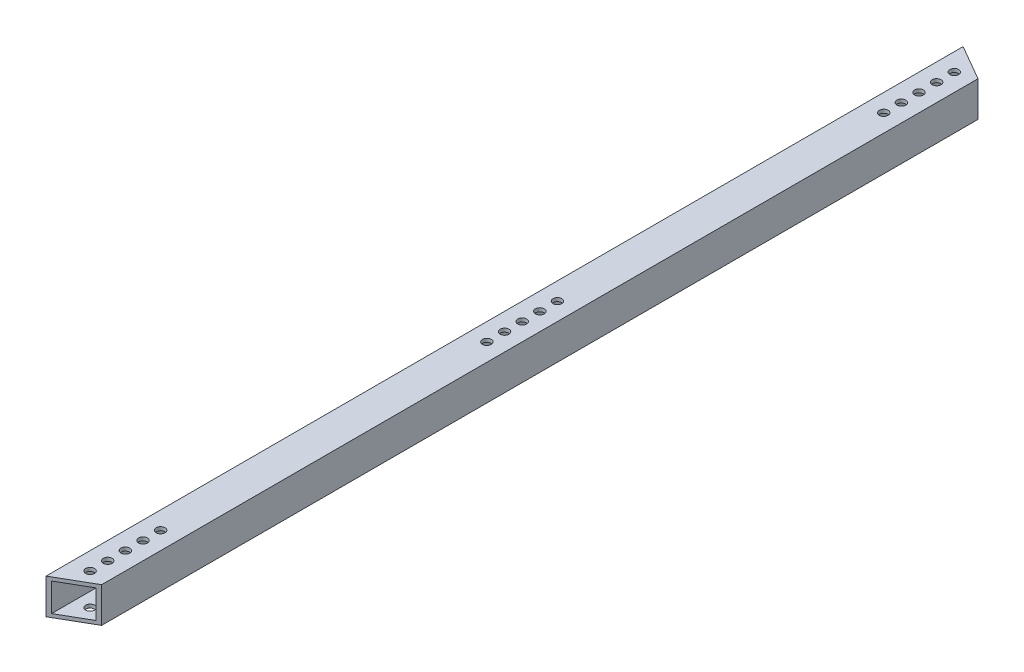
from build123d import *

# Parameters (mm, degrees)
SKETCH1_W           = 25.4
SKETCH1_H           = 25.4
SKETCH1_W_2         = 20.32
SKETCH1_H_2         = 20.32
BOSS_EXTRUDE2_DEPTH = 660.4
CUT_EXTRUDE1_DEPTH  = 662.010294927
SKETCH3_R           = 3.175
CUT_EXTRUDE2_DEPTH  = 662.010294927


with BuildPart() as part:
    # Sketch1 → Boss-Extrude2 (new body)
    with BuildSketch(Plane.XY):
        Rectangle(SKETCH1_W, SKETCH1_H)
        Rectangle(SKETCH1_W_2, SKETCH1_H_2, mode=Mode.SUBTRACT)
    extrude(amount=BOSS_EXTRUDE2_DEPTH)

    # Sketch2 → Cut-Extrude1 (cut, through all)
    with BuildSketch(Plane(origin=(0, 12.7, 0), x_dir=(1, 0, 0), z_dir=(0, 1, 0))):
        Polygon((-12.7, -660.4), (12.7, -645.735303163), (12.7, -660.4), align=None)
        Polygon((12.7, 0), (-12.7, 0), (12.7, -14.664696837), align=None)
    extrude(amount=-CUT_EXTRUDE1_DEPTH, mode=Mode.SUBTRACT)

    # Sketch3 → Cut-Extrude2 (cut, through all)
    with BuildSketch(Plane(origin=(0, 12.7, 0), x_dir=(1, 0, 0), z_dir=(0, 1, 0))):
        with Locations(Location((0, -330.2, 0), (0, 0, 270))):
            Circle(SKETCH3_R)
        with Locations(Location((0, -317.5, 0), (0, 0, 270))):
            Circle(SKETCH3_R)
        with Locations(Location((0, -304.8, 0), (0, 0, 270))):
            Circle(SKETCH3_R)
        with Locations((0, -355.6)):
            Circle(SKETCH3_R)
        with Locations((0, -342.9)):
            Circle(SKETCH3_R)
        with Locations(Location((0, -641.35, 0), (0, 0, 270))):
            Circle(SKETCH3_R)
        with Locations(Location((0, -628.65, 0), (0, 0, 270))):
            Circle(SKETCH3_R)
        with Locations(Location((0, -615.95, 0), (0, 0, 270))):
            Circle(SKETCH3_R)
        with Locations(Location((0, -603.25, 0), (0, 0, 270))):
            Circle(SKETCH3_R)
        with Locations(Location((0, -590.55, 0), (0, 0, 270))):
            Circle(SKETCH3_R)
        with Locations((0, -69.85)):
            Circle(SKETCH3_R)
        with Locations((0, -57.15)):
            Circle(SKETCH3_R)
        with Locations((0, -44.45)):
            Circle(SKETCH3_R)
        with Locations((0, -31.75)):
            Circle(SKETCH3_R)
        with Locations((0, -19.05)):
            Circle(SKETCH3_R)
    extrude(amount=-CUT_EXTRUDE2_DEPTH, mode=Mode.SUBTRACT)


solid = part.part
